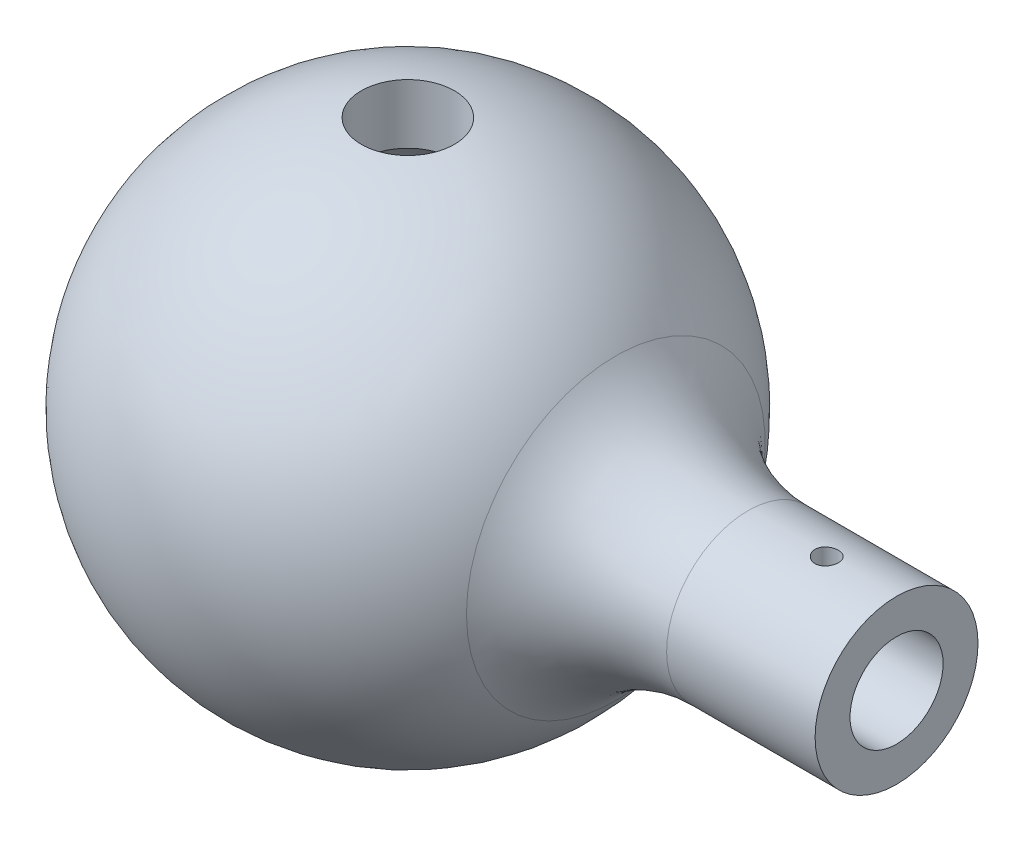
from build123d import *

# Parameters (mm, degrees)
COQUE1_T                     = 2.5
ENL_V_MAT_EXTRU_1_DEPTH      = 20.052558883
ENL_V_MAT_EXTRU_1_DEPTH_BACK = 20.052558883
ESQUISSE2_R                  = 2
ESQUISSE3_R                  = 3.5
ESQUISSE3_R_2                = 2
EXTRU_MINCE1_DEPTH           = 21
CONG_1_R                     = 7
ENL_V_MAT_EXTRU_2_DEPTH      = 27.057628564
ENL_V_MAT_EXTRU_2_DEPTH_BACK = 27.057628564
ESQUISSE5_R                  = 0.5


with BuildPart() as part:
    # Esquisse1 → Révolution1 (revolve)
    with BuildSketch(Plane.XY):
        with BuildLine():
            Line((-11, 0), (11, 0))
            ThreePointArc((11, 0), (0, 11), (-11, 0))
        make_face()
    revolve(axis=Axis((-11, 0, 0), (1, 0, 0)))

    # Coque1 (no face opened: a closed hollow body)
    add(offset(amount=-COQUE1_T, mode=Mode.PRIVATE), mode=Mode.SUBTRACT)

    # Esquisse2 → Enlèv. mat.-Extru.1 (cut, two sides: drawn at the far end of the back side and taken through both)
    with BuildSketch(Plane(origin=(0, 0, 0), x_dir=(1, 0, 0), z_dir=(0, 1, 0)).offset(-ENL_V_MAT_EXTRU_1_DEPTH_BACK)):
        with Locations(Location((0, 0, 0), (0, 0, 270))):
            Circle(ESQUISSE2_R)
    extrude(amount=ENL_V_MAT_EXTRU_1_DEPTH + ENL_V_MAT_EXTRU_1_DEPTH_BACK, mode=Mode.SUBTRACT)

    # Esquisse3 → Extru.-Mince1 (add)
    with BuildSketch(Plane(origin=(0, 0, 0), x_dir=(0, 0, -1), z_dir=(1, 0, 0))):
        Circle(ESQUISSE3_R)
        Circle(ESQUISSE3_R_2, mode=Mode.SUBTRACT)
    extrude(amount=EXTRU_MINCE1_DEPTH)

    # Congé1
    cong_1_edges = [part.edges().sort_by_distance(p)[0] for p in [
        (10.428326807, -2.474873734, 2.474873734),
    ]]
    fillet(cong_1_edges, radius=CONG_1_R)

    # Esquisse4 → Révolution4 (revolve)
    with BuildSketch(Plane.XY):
        with BuildLine():
            Line((-9.287174866, 5.894775909), (-12.493705663, 0.842910886))
            ThreePointArc((-12.493705663, 0.842910886), (-12.666967343, 0.460123427), (-12.727263641, 0.044298698))
            Line((-12.727263641, 0.044298698), (-9.307579549, 0.032396096))
            Line((-9.307579549, 0.032396096), (-9.287174866, 5.894775909))
        make_face()
    revolve(axis=Axis((-9.307579549, 0.032396096, 0), (-0.9999939427166084, 0.00348059335354882, 0)))

    # Esquisse5 → Enlèv. mat.-Extru.2 (cut, two sides: drawn at the far end of the back side and taken through both)
    with BuildSketch(Plane(origin=(0, 0, 0), x_dir=(1, 0, 0), z_dir=(0, 1, 0)).offset(-ENL_V_MAT_EXTRU_2_DEPTH_BACK)):
        with Locations(Location((18, 0, 0), (0, 0, 270))):
            Circle(ESQUISSE5_R)
    extrude(amount=ENL_V_MAT_EXTRU_2_DEPTH + ENL_V_MAT_EXTRU_2_DEPTH_BACK, mode=Mode.SUBTRACT)


solid = part.part
